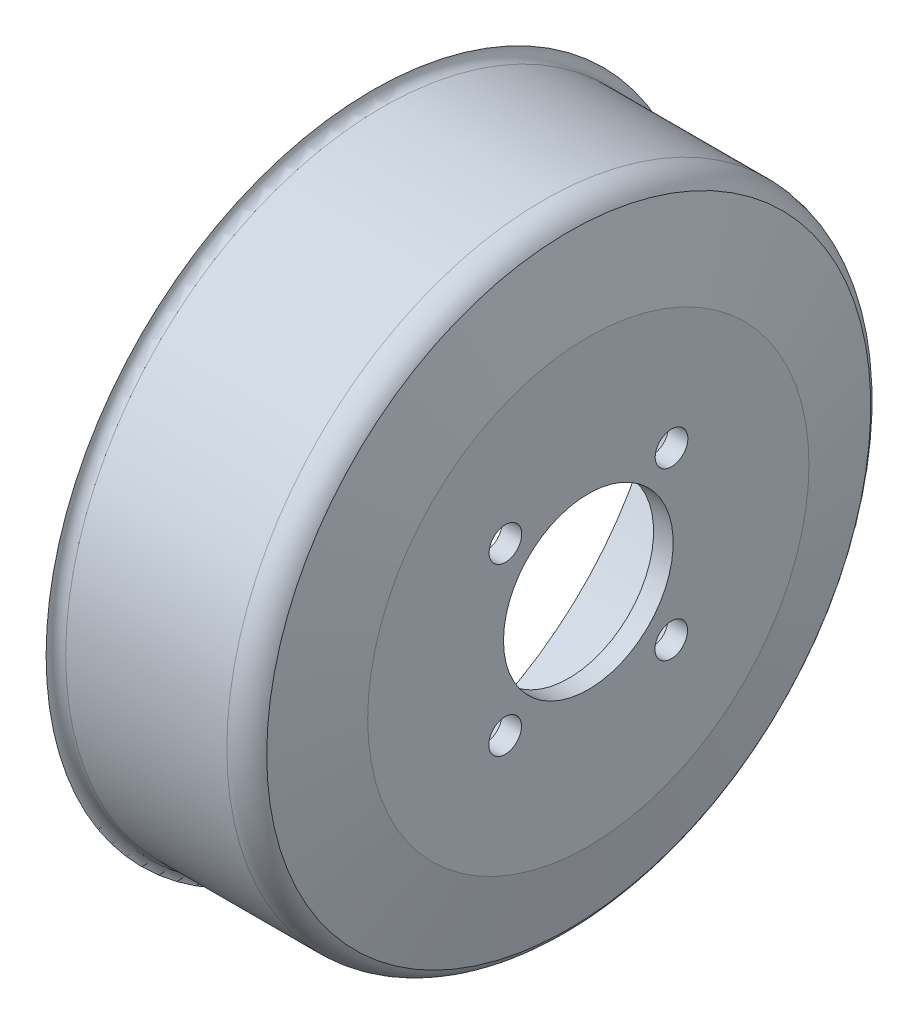
from build123d import *

# Parameters (mm, degrees)
SKETCH2_R          = 5
CUT_EXTRUDE1_DEPTH = 10


with BuildPart() as part:
    # Sketch1 → Revolve1 (revolve)
    with BuildSketch(Plane.XY, mode=Mode.PRIVATE) as revolve1_sk:
        with BuildLine():
            Line((15, 97), (60.316020873, 97))
            Line((60.316020873, 97), (64.382402521, 97))
            ThreePointArc((64.382402521, 97), (68.861218013, 95.806421189), (72.152073668, 92.542269286))
            Line((72.152073668, 92.542269286), (78.152073668, 67.613382081))
            Line((78.152073668, 67.613382081), (78.152073668, 26))
            Line((78.152073668, 26), (72.152073668, 26))
            Line((72.152073668, 26), (72.152073668, 67.613382081))
            Line((72.152073668, 67.613382081), (66.408193592, 89.472988604))
            ThreePointArc((66.408193592, 89.472988604), (65.32157431, 90.589825828), (63.81830321, 91))
            Line((63.81830321, 91), (12, 91))
            Line((12, 91), (12, 100))
            ThreePointArc((12, 100), (12.878679656, 97.878679656), (15, 97))
        make_face()
    revolve(revolve1_sk.sketch.rotate(Axis((-30.728161887, 0, 0), (1, 0, 0)), 90), axis=Axis((-30.728161887, 0, 0), (1, 0, 0)))

    # Sketch2 → Cut-Extrude1 (cut)
    with BuildSketch(Plane(origin=(78.152073668, 0, 0), x_dir=(0, 0, -1), z_dir=(1, 0, 0))):
        with Locations((-25.412524086, 25.499090564)):
            Circle(SKETCH2_R)
        with Locations((25.497475914, 25.414144133)):
            Circle(SKETCH2_R)
        with Locations((25.415769388, -25.495855867)):
            Circle(SKETCH2_R)
        with Locations((-25.494170251, -25.417460204)):
            Circle(SKETCH2_R)
    extrude(amount=-CUT_EXTRUDE1_DEPTH, mode=Mode.SUBTRACT)


solid = part.part
